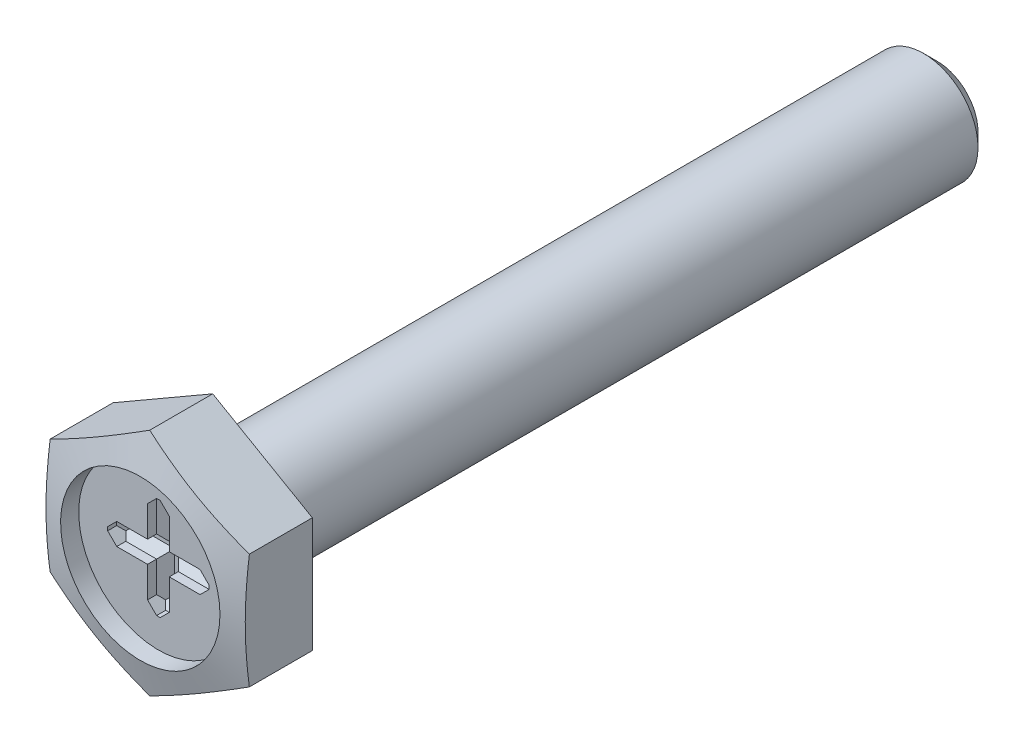
from build123d import *

# Parameters (mm, degrees)
EXTRUDE_1_DEPTH     = 2
SKETCH_3_R          = 1.5
EXTRUDE_3_DEPTH     = 20
SKETCH_7_R          = 2.2
CUT_EXTRUDE_3_DEPTH = 0.5
SKETCH_6_W          = 2.8
SKETCH_6_H          = 0.6
SKETCH_6_W_2        = 0.6
SKETCH_6_H_2        = 2.8
CUT_EXTRUDE_1_DEPTH = 0.5
CHAMFER_1_SIZE      = 0.375
FILLET_1_R          = 0.1
CHAMFER_2_SIZE      = 0.25
CHAMFER_3_SIZE      = 0.25


with BuildPart() as part:
    # 草图1 → 凸台-拉伸1 (new body)
    with BuildSketch(Plane.XY):
        Polygon((0, 3.175426481), (-2.75, 1.58771324), (-2.75, -1.58771324), (0, -3.175426481), (2.75, -1.58771324), (2.75, 1.58771324), align=None)
    extrude(amount=EXTRUDE_1_DEPTH)

    # 草图3 → 凸台-拉伸3 (add)
    with BuildSketch(Plane.XY):
        Circle(SKETCH_3_R)
    extrude(amount=-EXTRUDE_3_DEPTH)

    # 草图4 → 切除-旋转1 (revolve, cut)
    with BuildSketch(Plane(origin=(0, 0, 0), x_dir=(0, 0, -1), z_dir=(1, 0, 0)), mode=Mode.PRIVATE) as cut_revolve_1_sk:
        Polygon((-2, 11), (-2, 2.2), (0.357952893, 11), align=None)
    revolve(cut_revolve_1_sk.sketch.rotate(Axis((0, 0, -2.242017917), (0, 0, 1)), 90), axis=Axis((0, 0, -2.242017917), (0, 0, 1)), mode=Mode.SUBTRACT)

    # 草图7 → 切除-拉伸3 (cut)
    with BuildSketch(Plane.XY.offset(2)):
        Circle(SKETCH_7_R)
    extrude(amount=-CUT_EXTRUDE_3_DEPTH, mode=Mode.SUBTRACT)

    # 草图6 → 切除-拉伸1 (cut)
    with BuildSketch(Plane.XY.offset(1.5)):
        Rectangle(SKETCH_6_W, SKETCH_6_H)
        Rectangle(SKETCH_6_W_2, SKETCH_6_H_2)
    extrude(amount=-CUT_EXTRUDE_1_DEPTH, mode=Mode.SUBTRACT)

    # 倒角1
    chamfer_1_edges = [part.edges().sort_by_distance(p)[0] for p in [
        (-1.5, 0, -20),
    ]]
    chamfer(chamfer_1_edges, length=CHAMFER_1_SIZE)

    # 圆角1
    fillet_1_edges = [part.edges().sort_by_distance(p)[0] for p in [
        (-1.5, 0, 0),
    ]]
    fillet(fillet_1_edges, radius=FILLET_1_R)

    # 倒角2
    chamfer_2_edges = [part.edges().sort_by_distance(p)[0] for p in [
        (0.3, 0.85, 1),
        (0.85, 0.3, 1),
        (-0.3, -0.85, 1),
        (-1.4, 0, 1),
        (-0.85, 0.3, 1),
        (-0.3, 0.85, 1),
        (0, 1.4, 1),
        (0, -1.4, 1),
        (0.3, -0.85, 1),
        (-0.85, -0.3, 1),
        (1.4, 0, 1),
        (0.85, -0.3, 1),
    ]]
    chamfer(chamfer_2_edges, length=CHAMFER_2_SIZE)

    # 倒角3
    chamfer_3_edges = [part.edges().sort_by_distance(p)[0] for p in [
        (1.4, 0.3, 1.375),
        (1.4, -0.3, 1.375),
        (0.3, -1.4, 1.375),
        (-0.3, -1.4, 1.375),
        (-1.4, -0.3, 1.375),
        (-1.4, 0.3, 1.375),
        (-0.3, 1.4, 1.375),
        (0.3, 1.4, 1.375),
    ]]
    chamfer(chamfer_3_edges, length=CHAMFER_3_SIZE)


solid = part.part
